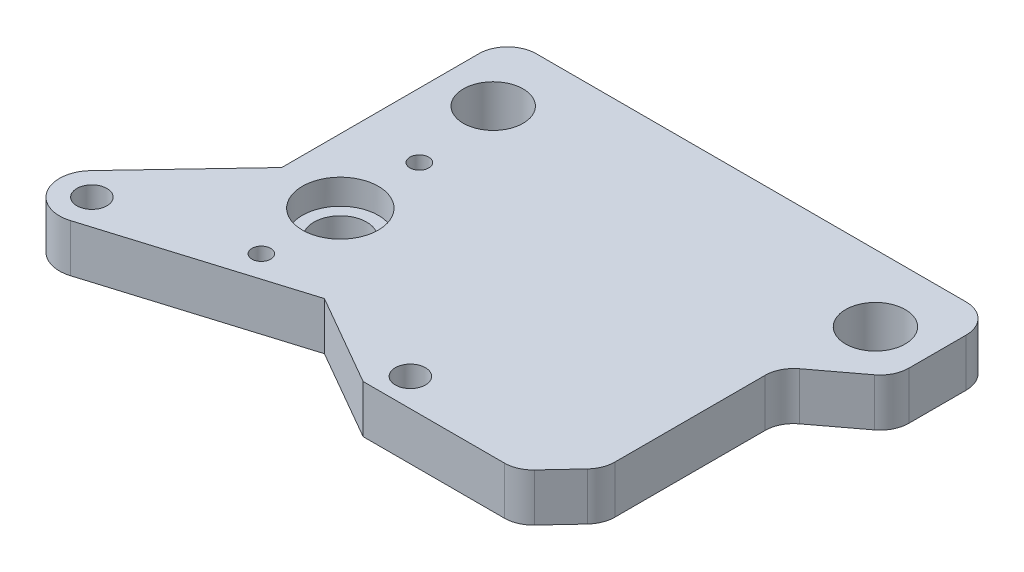
from build123d import *

# Parameters (mm, degrees)
SKETCH4_R           = 2
SKETCH4_R_2         = 1.25
SKETCH4_R_3         = 5.05
SKETCH4_R_4         = 3.96875
BOSS_EXTRUDE2_DEPTH = 6.35
SKETCH31_R          = 6.35
SKETCH31_R_2        = 3.499999985
BOSS_EXTRUDE5_DEPTH = 3


with BuildPart() as part:
    # Sketch4 → Boss-Extrude2 (new body)
    # profile 1 of 2: a face of its own
    with BuildSketch(Plane(origin=(0, 0, 0), x_dir=(1, 0, 0), z_dir=(0, 1, 0))):
        with BuildLine():
            Line((21.46596982, -18.4375), (40.257702493, -18.4375))
            ThreePointArc((40.257702493, -18.4375), (41.776936446, -18.121498883), (43.044160097, -17.225913752))
            Line((43.044160097, -17.225913752), (46.444939319, -13.579024524))
            ThreePointArc((46.444939319, -13.579024524), (47.203372649, -12.376980446), (47.468481715, -10.980610773))
            Line((47.468481715, -10.980610773), (47.468481715, 8.985116992))
            ThreePointArc((47.468481715, 8.985116992), (47.868781798, 10.685130659), (48.985566477, 12.027918285))
            Line((48.985566477, 12.027918285), (54.680415238, 16.319294633))
            ThreePointArc((54.680415238, 16.319294633), (55.797199918, 17.662082259), (56.1975, 19.362095927))
            Line((56.1975, 19.362095927), (56.1975, 26.9875))
            ThreePointArc((56.1975, 26.9875), (55.081576836, 29.681576836), (52.3875, 30.7975))
            Line((52.3875, 30.7975), (-4.7625, 30.7975))
            ThreePointArc((-4.7625, 30.7975), (-7.456576836, 29.681576836), (-8.5725, 26.9875))
            Line((-8.5725, 26.9875), (-8.5725, 0.781747009))
            Line((-8.5725, 0.781747009), (-20.917416467, -12.27322702))
            ThreePointArc((-20.917416467, -12.27322702), (-21.4498857, -17.515316011), (-16.517810325, -19.369406885))
            Line((-16.517810325, -19.369406885), (9.346561417, -11.463733294))
            Line((9.346561417, -11.463733294), (21.46596982, -18.4375))
        make_face()
        with Locations(Location((-17.78, -15.24, 0), (0, 0, 270))):
            Circle(SKETCH4_R, mode=Mode.SUBTRACT)
        with Locations(Location((0, -10.5, 0), (0, 0, 270))):
            Circle(SKETCH4_R_2, mode=Mode.SUBTRACT)
        with Locations(Location((0, 0, 0), (0, 0, 270))):
            Circle(SKETCH4_R_3, mode=Mode.SUBTRACT)
        with Locations(Location((24.012521227, -14.703599027, 0), (0, 0, 270))):
            Circle(SKETCH4_R, mode=Mode.SUBTRACT)
        with Locations(Location((0, 10.5, 0), (0, 0, 270))):
            Circle(SKETCH4_R_2, mode=Mode.SUBTRACT)
        with Locations(Location((-1.5875, 21.9075, 0), (0, 0, 270))):
            Circle(SKETCH4_R_4, mode=Mode.SUBTRACT)
        with Locations(Location((49.2125, 21.9075, 0), (0, 0, 270))):
            Circle(SKETCH4_R_4, mode=Mode.SUBTRACT)
    # profile 2 of 2: a face of its own
    with BuildSketch(Plane(origin=(0, 0, 0), x_dir=(1, 0, 0), z_dir=(0, 1, 0))):
        with BuildLine():
            Line((21.46596982, -18.4375), (40.257702493, -18.4375))
            ThreePointArc((40.257702493, -18.4375), (41.776936446, -18.121498883), (43.044160097, -17.225913752))
            Line((43.044160097, -17.225913752), (46.444939319, -13.579024524))
            ThreePointArc((46.444939319, -13.579024524), (47.203372649, -12.376980446), (47.468481715, -10.980610773))
            Line((47.468481715, -10.980610773), (47.468481715, 8.985116992))
            ThreePointArc((47.468481715, 8.985116992), (47.868781798, 10.685130659), (48.985566477, 12.027918285))
            Line((48.985566477, 12.027918285), (54.680415238, 16.319294633))
            ThreePointArc((54.680415238, 16.319294633), (55.797199918, 17.662082259), (56.1975, 19.362095927))
            Line((56.1975, 19.362095927), (56.1975, 26.9875))
            ThreePointArc((56.1975, 26.9875), (55.081576836, 29.681576836), (52.3875, 30.7975))
            Line((52.3875, 30.7975), (-4.7625, 30.7975))
            ThreePointArc((-4.7625, 30.7975), (-7.456576836, 29.681576836), (-8.5725, 26.9875))
            Line((-8.5725, 26.9875), (-8.5725, 0.781747009))
            Line((-8.5725, 0.781747009), (-20.917416467, -12.27322702))
            ThreePointArc((-20.917416467, -12.27322702), (-21.4498857, -17.515316011), (-16.517810325, -19.369406885))
            Line((-16.517810325, -19.369406885), (9.346561417, -11.463733294))
            Line((9.346561417, -11.463733294), (21.46596982, -18.4375))
        make_face()
        with Locations(Location((-17.78, -15.24, 0), (0, 0, 270))):
            Circle(SKETCH4_R, mode=Mode.SUBTRACT)
        with Locations(Location((0, -10.5, 0), (0, 0, 270))):
            Circle(SKETCH4_R_2, mode=Mode.SUBTRACT)
        with Locations(Location((0, 0, 0), (0, 0, 270))):
            Circle(SKETCH4_R_3, mode=Mode.SUBTRACT)
        with Locations(Location((24.012521227, -14.703599027, 0), (0, 0, 270))):
            Circle(SKETCH4_R, mode=Mode.SUBTRACT)
        with Locations(Location((0, 10.5, 0), (0, 0, 270))):
            Circle(SKETCH4_R_2, mode=Mode.SUBTRACT)
        with Locations(Location((-1.5875, 21.9075, 0), (0, 0, 270))):
            Circle(SKETCH4_R_4, mode=Mode.SUBTRACT)
        with Locations(Location((49.2125, 21.9075, 0), (0, 0, 270))):
            Circle(SKETCH4_R_4, mode=Mode.SUBTRACT)
    extrude(amount=-BOSS_EXTRUDE2_DEPTH)

    # Sketch31 → Boss-Extrude5 (add)
    with BuildSketch(Plane.XZ.offset(6.35)):
        Circle(SKETCH31_R)
        with Locations(Location((0, 0, 0), (0, 0, 270))):
            Circle(SKETCH31_R_2, mode=Mode.SUBTRACT)
    extrude(amount=-BOSS_EXTRUDE5_DEPTH)


solid = part.part
